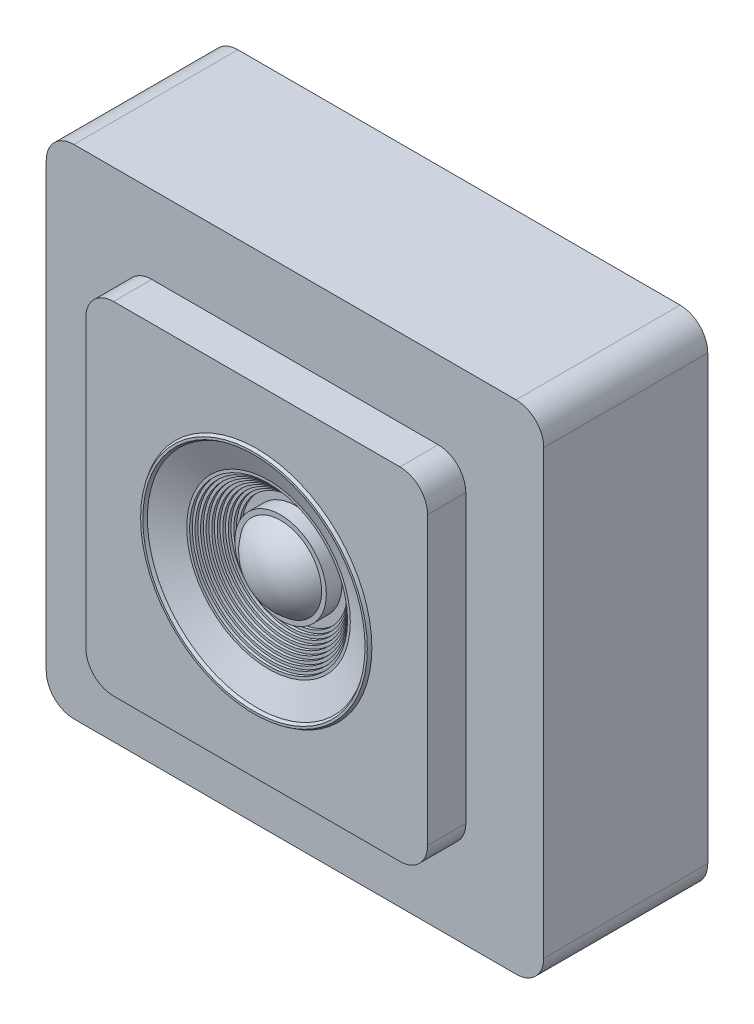
from build123d import *

# Parameters (mm, degrees)
BOSS_EXTRUDE1_DEPTH = 11.868131868
SKETCH2_R           = 1.5
CUT_EXTRUDE1_DEPTH  = 5
BOSS_EXTRUDE2_DEPTH = 2.769230769
SKETCH7_W           = 8.5
SKETCH7_H           = 4.8
SKETCH7_W_2         = 0.5
SKETCH7_H_2         = 0.5
CUT_EXTRUDE2_DEPTH  = 10


with BuildPart() as part:
    # Sketch1 → Boss-Extrude1 (new body)
    with BuildSketch(Plane.XY):
        with BuildLine():
            Line((-16, 18), (16, 18))
            ThreePointArc((16, 18), (17.414213562, 17.414213562), (18, 16))
            Line((18, 16), (18, -16))
            ThreePointArc((18, -16), (17.414213562, -17.414213562), (16, -18))
            Line((16, -18), (-16, -18))
            ThreePointArc((-16, -18), (-17.414213562, -17.414213562), (-18, -16))
            Line((-18, -16), (-18, 16))
            ThreePointArc((-18, 16), (-17.414213562, 17.414213562), (-16, 18))
        make_face()
    extrude(amount=BOSS_EXTRUDE1_DEPTH)

    # Sketch2 → Cut-Extrude1 (cut)
    with BuildSketch(Plane(origin=(0, 0, 0), x_dir=(-1, 0, 0), z_dir=(0, 0, -1))):
        with Locations((-13.554503907, -13.802086098)):
            Circle(SKETCH2_R)
        with Locations((14.445496093, 14.197913902)):
            Circle(SKETCH2_R)
    extrude(amount=-CUT_EXTRUDE1_DEPTH, mode=Mode.SUBTRACT)

    # Sketch3 → Boss-Extrude2 (add)
    with BuildSketch(Plane.XY.offset(11.868131868)):
        with BuildLine():
            Line((-10.362637363, 12.362637363), (10.362637363, 12.362637363))
            ThreePointArc((10.362637363, 12.362637363), (11.776850925, 11.776850925), (12.362637363, 10.362637363))
            Line((12.362637363, 10.362637363), (12.362637363, -10.362637363))
            ThreePointArc((12.362637363, -10.362637363), (11.776850925, -11.776850925), (10.362637363, -12.362637363))
            Line((10.362637363, -12.362637363), (-10.362637363, -12.362637363))
            ThreePointArc((-10.362637363, -12.362637363), (-11.776850925, -11.776850925), (-12.362637363, -10.362637363))
            Line((-12.362637363, -10.362637363), (-12.362637363, 10.362637363))
            ThreePointArc((-12.362637363, 10.362637363), (-11.776850925, 11.776850925), (-10.362637363, 12.362637363))
        make_face()
    extrude(amount=BOSS_EXTRUDE2_DEPTH)

    # Sketch4 → Revolve1 (revolve)
    with BuildSketch(Plane(origin=(0, 0, 0), x_dir=(1, 0, 0), z_dir=(0, 1, 0)), mode=Mode.PRIVATE) as revolve1_sk:
        Polygon((-8.33139296, -14.637362637), (-8.202720326, -14.837362637), (-8.040760547, -14.837362637), (-7.912087912, -14.637362637), align=None)
    revolve(revolve1_sk.sketch.rotate(Axis((0, 0, 15.476177455), (0, 0, 1)), 180), axis=Axis((0, 0, 15.476177455), (0, 0, 1)))

    # Sketch5 → Cut-Revolve1 (revolve, cut)
    with BuildSketch(Plane(origin=(0, 0, 0), x_dir=(1, 0, 0), z_dir=(0, 1, 0)), mode=Mode.PRIVATE) as cut_revolve1_sk:
        Polygon((-7.912087912, -14.637362637), (-5.918480504, -13.782101407), (-5.718480504, -13.782101407), (-5.718480504, -13.582101407), (-5.518480504, -13.582101407), (-5.518480504, -13.382101407), (-5.318480504, -13.382101407), (-5.318480504, -13.182101407), (-5.118480504, -13.182101407), (-5.118480504, -12.982101407), (-4.918480504, -12.982101407), (-4.918480504, -12.782101407), (-4.718480504, -12.782101407), (-4.718480504, -12.582101407), (-4.518480504, -12.582101407), (-4.518480504, -12.382101407), (-4.318480504, -12.382101407), (-4.318480504, -12.182101407), (-4.118480504, -12.182101407), (-4.118480504, -11.982101407), (-3.918480504, -11.982101407), (-3.918480504, -11.782101407), (0, -11.782101407), (0, -14.637362637), align=None)
    revolve(cut_revolve1_sk.sketch.rotate(Axis((0, 0, 19.146341311), (0, 0, -1)), 180), axis=Axis((0, 0, 19.146341311), (0, 0, -1)), mode=Mode.SUBTRACT)

    # Sketch6 → Revolve2 (revolve)
    with BuildSketch(Plane(origin=(0, 0, 0), x_dir=(1, 0, 0), z_dir=(0, 1, 0))):
        with BuildLine():
            Line((-3.308329692, -11.782101407), (-3.308329692, -12.908378043))
            Line((-3.308329692, -12.908378043), (-2.963068503, -12.908378043))
            ThreePointArc((-2.963068503, -12.908378043), (-1.670669607, -14.043416814), (0, -14.452649))
            Line((0, -14.452649), (0, -11.782101407))
            Line((0, -11.782101407), (-3.308329692, -11.782101407))
        make_face()
    revolve(axis=Axis((0, 0, 14.452649), (0, 0, -1)))

    # Sketch7 → Cut-Extrude2 (cut)
    with BuildSketch(Plane(origin=(0, 0, 0), x_dir=(-1, 0, 0), z_dir=(0, 0, -1))):
        with Locations((6.826923077, -13.028571429)):
            Rectangle(SKETCH7_W, SKETCH7_H)
        with Locations((4.064707138, -12.284956035)):
            Rectangle(SKETCH7_W_2, SKETCH7_H_2, mode=Mode.SUBTRACT)
        with Locations((5.906184431, -12.284956035)):
            Rectangle(SKETCH7_W_2, SKETCH7_H_2, mode=Mode.SUBTRACT)
        with Locations((7.747661723, -12.284956035)):
            Rectangle(SKETCH7_W_2, SKETCH7_H_2, mode=Mode.SUBTRACT)
        with Locations((9.589139016, -12.284956035)):
            Rectangle(SKETCH7_W_2, SKETCH7_H_2, mode=Mode.SUBTRACT)
    extrude(amount=-CUT_EXTRUDE2_DEPTH, mode=Mode.SUBTRACT)


solid = part.part
